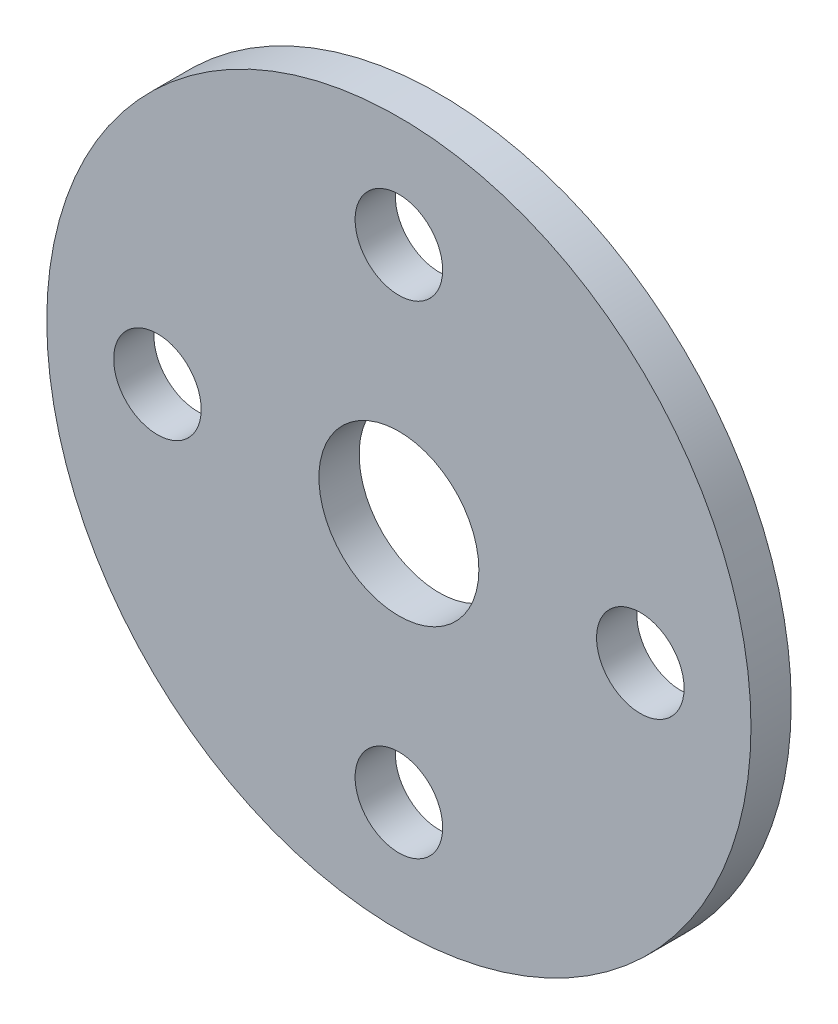
from build123d import *

# Parameters (mm, degrees)
SKETCH1_R           = 17.5
SKETCH1_R_2         = 2.175
SKETCH1_R_3         = 3.975
BOSS_EXTRUDE1_DEPTH = 2


with BuildPart() as part:
    # Sketch1 → Boss-Extrude1 (new body)
    with BuildSketch(Plane.XY):
        Circle(SKETCH1_R)
        with Locations((12, 0)):
            Circle(SKETCH1_R_2, mode=Mode.SUBTRACT)
        with Locations((0, 12)):
            Circle(SKETCH1_R_2, mode=Mode.SUBTRACT)
        with Locations((-12, 0)):
            Circle(SKETCH1_R_2, mode=Mode.SUBTRACT)
        with Locations((0, -12)):
            Circle(SKETCH1_R_2, mode=Mode.SUBTRACT)
        Circle(SKETCH1_R_3, mode=Mode.SUBTRACT)
    extrude(amount=BOSS_EXTRUDE1_DEPTH)


solid = part.part
